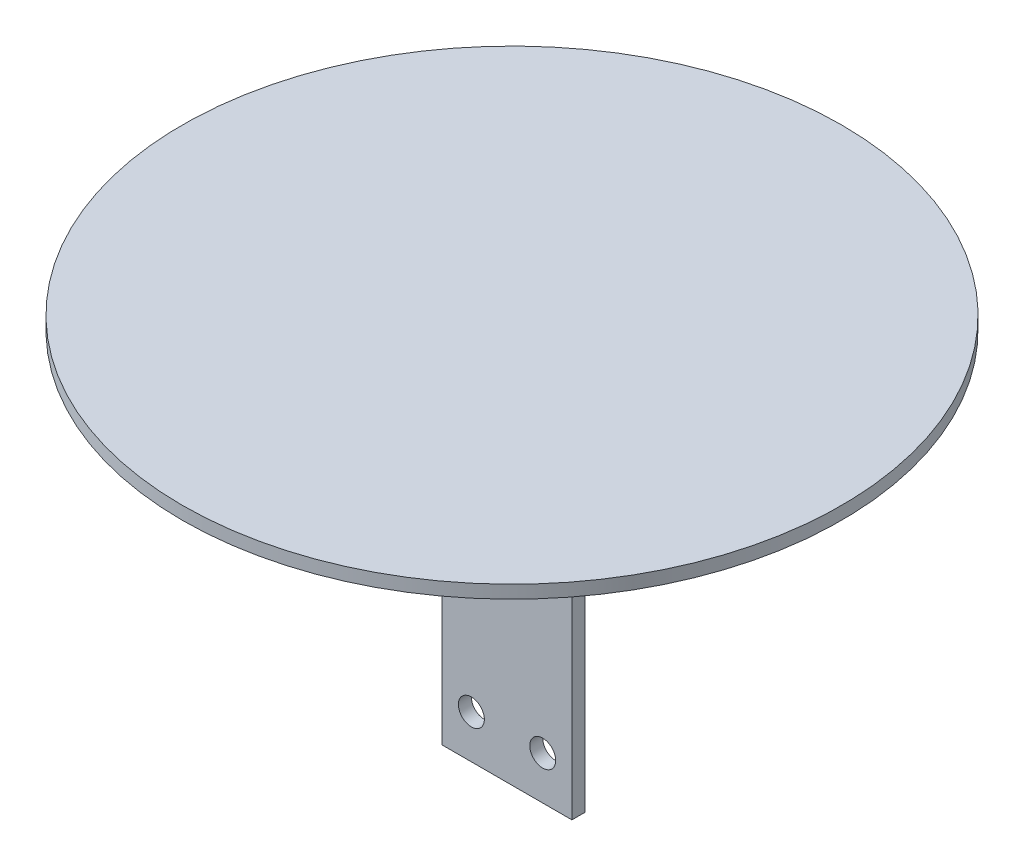
from build123d import *

# Parameters (mm, degrees)
SKETCH2_W           = 30
SKETCH2_H           = 90
SKETCH2_R           = 3
BOSS_EXTRUDE1_DEPTH = 3
SKETCH3_R           = 76.2
BOSS_EXTRUDE2_DEPTH = 3
SKETCH4_W           = 40
SKETCH4_H           = 10
BOSS_EXTRUDE3_DEPTH = 3
SKETCH5_W           = 40
SKETCH5_H           = 10
BOSS_EXTRUDE4_DEPTH = 3


with BuildPart() as part:
    # Sketch2 → Boss-Extrude1 (new body)
    with BuildSketch(Plane.XY):
        Rectangle(SKETCH2_W, SKETCH2_H)
        with Locations((-8.25, 20)):
            Circle(SKETCH2_R, mode=Mode.SUBTRACT)
        with Locations((8.25, 20)):
            Circle(SKETCH2_R, mode=Mode.SUBTRACT)
        with Locations((-8.25, -35)):
            Circle(SKETCH2_R, mode=Mode.SUBTRACT)
        with Locations((8.25, -35)):
            Circle(SKETCH2_R, mode=Mode.SUBTRACT)
    extrude(amount=BOSS_EXTRUDE1_DEPTH)

    # Sketch3 → Boss-Extrude2 (add)
    with BuildSketch(Plane(origin=(0, 45, 0), x_dir=(1, 0, 0), z_dir=(0, 1, 0))):
        with Locations(Location((0, -1.855318654, 0), (0, 0, 270))):
            Circle(SKETCH3_R)
    extrude(amount=BOSS_EXTRUDE2_DEPTH)

    # Sketch4 → Boss-Extrude3 (add)
    with BuildSketch(Plane(origin=(15, 0, 0), x_dir=(0, 0, -1), z_dir=(1, 0, 0))):
        with Locations((-1.5, 40)):
            Rectangle(SKETCH4_W, SKETCH4_H)
    extrude(amount=-BOSS_EXTRUDE3_DEPTH)

    # Sketch5 → Boss-Extrude4 (add)
    with BuildSketch(Plane.ZY.offset(15)):
        with Locations((1.5, 40)):
            Rectangle(SKETCH5_W, SKETCH5_H)
    extrude(amount=-BOSS_EXTRUDE4_DEPTH)


solid = part.part
